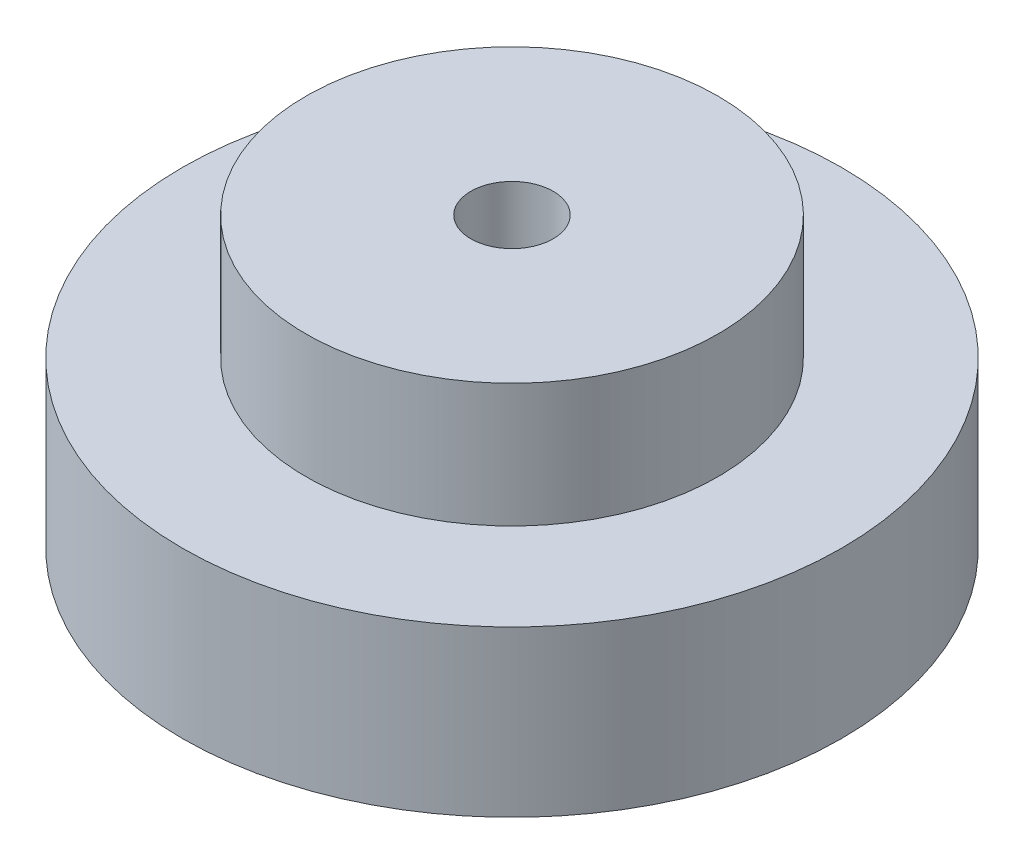
from build123d import *

# Parameters (mm, degrees)
HOLE_WIZARD_M6_2_D = 5


with BuildPart() as part:
    # 草图1 → 旋转1 (revolve)
    with BuildSketch(Plane.XY, mode=Mode.PRIVATE) as revolve_1_sk:
        Polygon((10, 30), (50, 30), (50, 0), (80, 0), (80, -40), (33.191510013, -40), (15, -40), (15, -30), (0, -30), (0, 0), (10, 0), align=None)
    revolve(revolve_1_sk.sketch.rotate(Axis((0, -30, 0), (0, 1, 0)), 90), axis=Axis((0, -30, 0), (0, 1, 0)))

    # M6 螺纹孔2 (through all)
    with Locations(Plane(origin=(0, -30, 0), x_dir=(-1, 0, 0), z_dir=(0, -1, 0))):
        with Locations((0, 0)):
            Hole(HOLE_WIZARD_M6_2_D / 2)


solid = part.part
